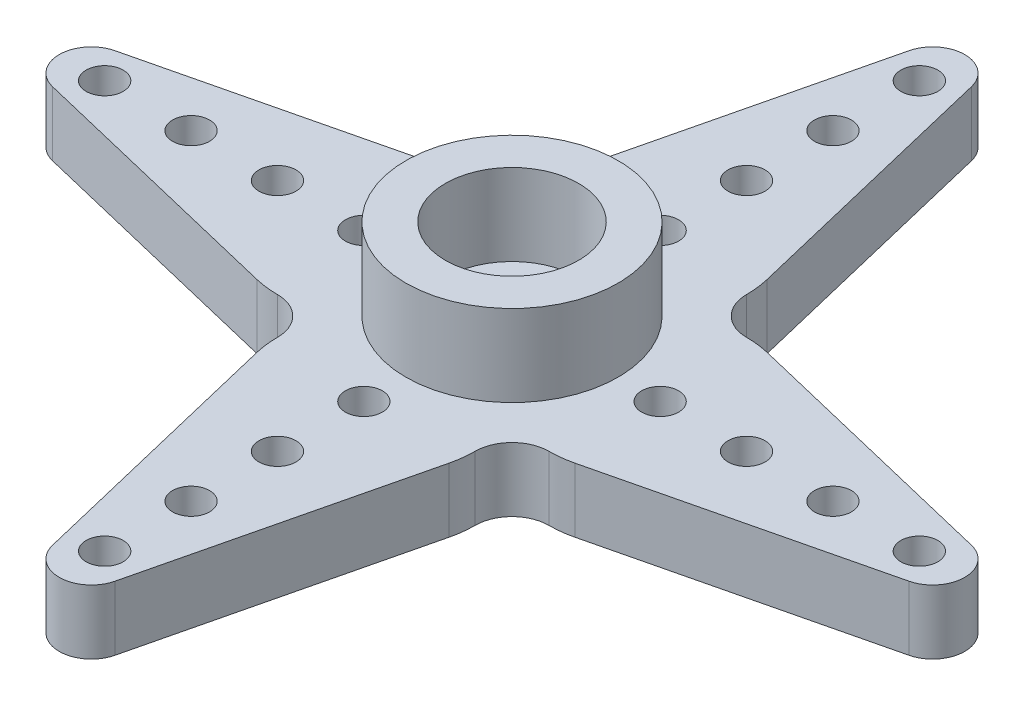
from build123d import *

# Parameters (mm, degrees)
BOSS_EXTRUDE1_DEPTH         = 2.6
SKETCH2_R                   = 1.5
CUT_EXTRUDE1_DEPTH          = 27.066668372
SKETCH3_R                   = 0.75
CUT_EXTRUDE2_DEPTH          = 27.066668372
LPATTERN1_COUNT             = 4
LPATTERN1_PITCH             = 3.5
CIRPATTERN1_COUNT           = 4
CIRPATTERN1_COPY_1_SKETCH_R = 0.75
CIRPATTERN1_COPY_1_DEPTH    = 27.066668372
CIRPATTERN1_COPY_2_SKETCH_R = 0.75
CIRPATTERN1_COPY_2_DEPTH    = 27.066668372
CIRPATTERN1_COPY_3_SKETCH_R = 0.75
CIRPATTERN1_COPY_3_DEPTH    = 27.066668372
CIRPATTERN1_COPY_4_SKETCH_R = 0.75
CIRPATTERN1_COPY_4_DEPTH    = 27.066668372
CIRPATTERN1_COPY_5_SKETCH_R = 0.75
CIRPATTERN1_COPY_5_DEPTH    = 27.066668372
CIRPATTERN1_COPY_6_SKETCH_R = 0.75
CIRPATTERN1_COPY_6_DEPTH    = 27.066668372
CIRPATTERN1_COPY_7_SKETCH_R = 0.75
CIRPATTERN1_COPY_7_DEPTH    = 27.066668372
CIRPATTERN1_COPY_8_SKETCH_R = 0.75
CIRPATTERN1_COPY_8_DEPTH    = 27.066668372
CIRPATTERN1_COPY_9_SKETCH_R = 0.75
CIRPATTERN1_COPY_9_DEPTH    = 27.066668372
SKETCH4_R                   = 4.3
SKETCH4_R_2                 = 2.7
BOSS_EXTRUDE2_DEPTH         = 3.3
SKETCH5_R                   = 4.3
SKETCH5_R_2                 = 2.7
SKETCH5_R_3                 = 2.2
SKETCH5_R_4                 = 1.5
CUT_EXTRUDE3_DEPTH          = 1


with BuildPart() as part:
    # Sketch1 → Boss-Extrude1 (new body)
    with BuildSketch(Plane(origin=(0, 0, 0), x_dir=(1, 0, 0), z_dir=(0, 1, 0))):
        with BuildLine():
            Line((-1.263917336, 17.344159445), (-3.888976418, 6.435875217))
            ThreePointArc((-3.888976418, 6.435875217), (-3.972147132, 5.971218807), (-4, 5.5))
            ThreePointArc((-4, 5.5), (-4.439339828, 4.439339828), (-5.5, 4))
            ThreePointArc((-5.5, 4), (-5.971218807, 3.972147132), (-6.435875217, 3.888976418))
            Line((-6.435875217, 3.888976418), (-17.344159445, 1.263917336))
            ThreePointArc((-17.344159445, 1.263917336), (-18.34, 0), (-17.344159445, -1.263917336))
            Line((-17.344159445, -1.263917336), (-6.435875217, -3.888976418))
            ThreePointArc((-6.435875217, -3.888976418), (-5.971218807, -3.972147132), (-5.5, -4))
            ThreePointArc((-5.5, -4), (-4.439339828, -4.439339828), (-4, -5.5))
            ThreePointArc((-4, -5.5), (-3.972147132, -5.971218807), (-3.888976418, -6.435875217))
            Line((-3.888976418, -6.435875217), (-1.263917336, -17.344159445))
            ThreePointArc((-1.263917336, -17.344159445), (0, -18.34), (1.263917336, -17.344159445))
            Line((1.263917336, -17.344159445), (3.888976418, -6.435875217))
            ThreePointArc((3.888976418, -6.435875217), (3.972147132, -5.971218807), (4, -5.5))
            ThreePointArc((4, -5.5), (4.439339828, -4.439339828), (5.5, -4))
            ThreePointArc((5.5, -4), (5.971218807, -3.972147132), (6.435875217, -3.888976418))
            Line((6.435875217, -3.888976418), (17.344159445, -1.263917336))
            ThreePointArc((17.344159445, -1.263917336), (18.34, 0), (17.344159445, 1.263917336))
            Line((17.344159445, 1.263917336), (6.435875217, 3.888976418))
            ThreePointArc((6.435875217, 3.888976418), (5.971218807, 3.972147132), (5.5, 4))
            ThreePointArc((5.5, 4), (4.439339828, 4.439339828), (4, 5.5))
            ThreePointArc((4, 5.5), (3.972147132, 5.971218807), (3.888976418, 6.435875217))
            Line((3.888976418, 6.435875217), (1.263917336, 17.344159445))
            ThreePointArc((1.263917336, 17.344159445), (0, 18.34), (-1.263917336, 17.344159445))
        make_face()
    extrude(amount=BOSS_EXTRUDE1_DEPTH)

    # Sketch2 → Cut-Extrude1 (cut, through all)
    with BuildSketch(Plane(origin=(0, 2.6, 0), x_dir=(1, 0, 0), z_dir=(0, 1, 0))):
        with Locations(Location((0, 0, 0), (0, 0, 270))):
            Circle(SKETCH2_R)
    extrude(amount=-CUT_EXTRUDE1_DEPTH, mode=Mode.SUBTRACT)

    # Sketch3 → Cut-Extrude2 (cut, through all)
    with BuildSketch(Plane(origin=(0, 2.6, 0), x_dir=(1, 0, 0), z_dir=(0, 1, 0))):
        with Locations(Location((0, 6, 0), (0, 0, 270))):
            Circle(SKETCH3_R)
    cut_extrude2 = extrude(amount=-CUT_EXTRUDE2_DEPTH, mode=Mode.SUBTRACT)

    # LPattern1: Cut-Extrude2 ×4
    with Locations(*[(0, 0, -i * LPATTERN1_PITCH) for i in range(1, LPATTERN1_COUNT)]):
        add(cut_extrude2, mode=Mode.SUBTRACT)

    # CirPattern1: Cut-Extrude2 ×4 about axis
    cirpattern1_axis = Axis((0, 0, 0), (0, 1, 0))
    for i in range(1, CIRPATTERN1_COUNT):
        add(cut_extrude2.rotate(cirpattern1_axis, i * 360 / CIRPATTERN1_COUNT), mode=Mode.SUBTRACT)

    # CirPattern1 copy 1 sketch → CirPattern1 copy 1 (cut, through all)
    with BuildSketch(Plane(origin=(-3.5, 2.6, 0), x_dir=(0, 0, -1), z_dir=(0, 1, 0))):
        with Locations(Location((0, 6, 0), (0, 0, 270))):
            Circle(CIRPATTERN1_COPY_1_SKETCH_R)
    extrude(amount=-CIRPATTERN1_COPY_1_DEPTH, mode=Mode.SUBTRACT)

    # CirPattern1 copy 2 sketch → CirPattern1 copy 2 (cut, through all)
    with BuildSketch(Plane(origin=(0, 2.6, 3.5), x_dir=(-1, 0, 0), z_dir=(0, 1, 0))):
        with Locations(Location((0, 6, 0), (0, 0, 270))):
            Circle(CIRPATTERN1_COPY_2_SKETCH_R)
    extrude(amount=-CIRPATTERN1_COPY_2_DEPTH, mode=Mode.SUBTRACT)

    # CirPattern1 copy 3 sketch → CirPattern1 copy 3 (cut, through all)
    with BuildSketch(Plane(origin=(3.5, 2.6, 0), x_dir=(0, 0, 1), z_dir=(0, 1, 0))):
        with Locations(Location((0, 6, 0), (0, 0, 270))):
            Circle(CIRPATTERN1_COPY_3_SKETCH_R)
    extrude(amount=-CIRPATTERN1_COPY_3_DEPTH, mode=Mode.SUBTRACT)

    # CirPattern1 copy 4 sketch → CirPattern1 copy 4 (cut, through all)
    with BuildSketch(Plane(origin=(-7, 2.6, 0), x_dir=(0, 0, -1), z_dir=(0, 1, 0))):
        with Locations(Location((0, 6, 0), (0, 0, 270))):
            Circle(CIRPATTERN1_COPY_4_SKETCH_R)
    extrude(amount=-CIRPATTERN1_COPY_4_DEPTH, mode=Mode.SUBTRACT)

    # CirPattern1 copy 5 sketch → CirPattern1 copy 5 (cut, through all)
    with BuildSketch(Plane(origin=(0, 2.6, 7), x_dir=(-1, 0, 0), z_dir=(0, 1, 0))):
        with Locations(Location((0, 6, 0), (0, 0, 270))):
            Circle(CIRPATTERN1_COPY_5_SKETCH_R)
    extrude(amount=-CIRPATTERN1_COPY_5_DEPTH, mode=Mode.SUBTRACT)

    # CirPattern1 copy 6 sketch → CirPattern1 copy 6 (cut, through all)
    with BuildSketch(Plane(origin=(7, 2.6, 0), x_dir=(0, 0, 1), z_dir=(0, 1, 0))):
        with Locations(Location((0, 6, 0), (0, 0, 270))):
            Circle(CIRPATTERN1_COPY_6_SKETCH_R)
    extrude(amount=-CIRPATTERN1_COPY_6_DEPTH, mode=Mode.SUBTRACT)

    # CirPattern1 copy 7 sketch → CirPattern1 copy 7 (cut, through all)
    with BuildSketch(Plane(origin=(-10.5, 2.6, 0), x_dir=(0, 0, -1), z_dir=(0, 1, 0))):
        with Locations(Location((0, 6, 0), (0, 0, 270))):
            Circle(CIRPATTERN1_COPY_7_SKETCH_R)
    extrude(amount=-CIRPATTERN1_COPY_7_DEPTH, mode=Mode.SUBTRACT)

    # CirPattern1 copy 8 sketch → CirPattern1 copy 8 (cut, through all)
    with BuildSketch(Plane(origin=(0, 2.6, 10.5), x_dir=(-1, 0, 0), z_dir=(0, 1, 0))):
        with Locations(Location((0, 6, 0), (0, 0, 270))):
            Circle(CIRPATTERN1_COPY_8_SKETCH_R)
    extrude(amount=-CIRPATTERN1_COPY_8_DEPTH, mode=Mode.SUBTRACT)

    # CirPattern1 copy 9 sketch → CirPattern1 copy 9 (cut, through all)
    with BuildSketch(Plane(origin=(10.5, 2.6, 0), x_dir=(0, 0, 1), z_dir=(0, 1, 0))):
        with Locations(Location((0, 6, 0), (0, 0, 270))):
            Circle(CIRPATTERN1_COPY_9_SKETCH_R)
    extrude(amount=-CIRPATTERN1_COPY_9_DEPTH, mode=Mode.SUBTRACT)

    # Sketch4 → Boss-Extrude2 (add)
    with BuildSketch(Plane(origin=(0, 2.6, 0), x_dir=(1, 0, 0), z_dir=(0, 1, 0))):
        with Locations(Location((0, 0, 0), (0, 0, 270))):
            Circle(SKETCH4_R)
        with Locations(Location((0, 0, 0), (0, 0, 270))):
            Circle(SKETCH4_R_2, mode=Mode.SUBTRACT)
    extrude(amount=BOSS_EXTRUDE2_DEPTH)

    # Sketch5 → Cut-Extrude3 (cut)
    # profile 1 of 2: a face of its own
    with BuildSketch(Plane.XZ):
        with Locations(Location((0, 0, 0), (0, 0, 90))):
            Circle(SKETCH5_R)
        with Locations(Location((0, 0, 0), (0, 0, 90))):
            Circle(SKETCH5_R_2, mode=Mode.SUBTRACT)
    # profile 2 of 2: a face of its own
    with BuildSketch(Plane.XZ):
        with Locations(Location((0, 0, 0), (0, 0, 270))):
            Circle(SKETCH5_R_3)
        with Locations(Location((0, 0, 0), (0, 0, 90))):
            Circle(SKETCH5_R_4, mode=Mode.SUBTRACT)
    extrude(amount=-CUT_EXTRUDE3_DEPTH, mode=Mode.SUBTRACT)


solid = part.part
